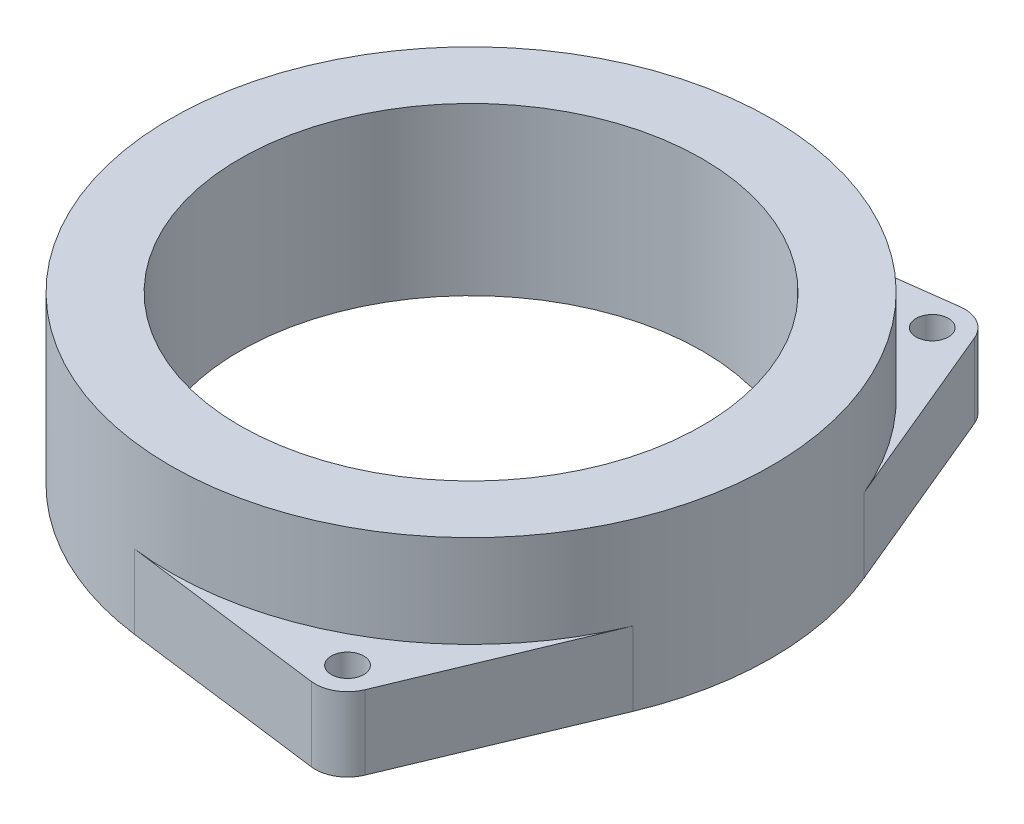
from build123d import *

# Parameters (mm, degrees)
CROQUIS1_R              = 25
CROQUIS1_R_2            = 1.75
SALIENTE_EXTRUIR1_DEPTH = 8
CROQUIS2_R              = 32.5
CROQUIS2_R_2            = 25
SALIENTE_EXTRUIR2_DEPTH = 10


with BuildPart() as part:
    # Croquis1 → Saliente-Extruir1 (new body)
    with BuildSketch(Plane(origin=(0, 0, 0), x_dir=(1, 0, 0), z_dir=(0, 1, 0))):
        with BuildLine():
            Line((-39.280821918, 2.125330436), (-25.821917808, 19.73521119))
            ThreePointArc((-25.821917808, 19.73521119), (-16.25, 28.145825623), (-4.180235335, 32.230042391))
            Line((-4.180235335, 32.230042391), (17.79982081, 35.08085488))
            ThreePointArc((17.79982081, 35.08085488), (20, 34.641016151), (21.481001108, 32.955524444))
            Line((21.481001108, 32.955524444), (30.002153144, 12.494831201))
            ThreePointArc((30.002153144, 12.494831201), (32.5, 0), (30.002153144, -12.494831201))
            Line((30.002153144, -12.494831201), (21.481001108, -32.955524444))
            ThreePointArc((21.481001108, -32.955524444), (20, -34.641016151), (17.79982081, -35.08085488))
            Line((17.79982081, -35.08085488), (-4.180235335, -32.230042391))
            ThreePointArc((-4.180235335, -32.230042391), (-16.25, -28.145825623), (-25.821917808, -19.73521119))
            Line((-25.821917808, -19.73521119), (-39.280821918, -2.125330436))
            ThreePointArc((-39.280821918, -2.125330436), (-40, 0), (-39.280821918, 2.125330436))
        make_face()
        with Locations(Location((0, 0, 0), (0, 0, 270))):
            Circle(CROQUIS1_R, mode=Mode.SUBTRACT)
        with Locations(Location((18.25, 31.609927238, 0), (0, 0, 270))):
            Circle(CROQUIS1_R_2, mode=Mode.SUBTRACT)
        with Locations(Location((-36.5, 0, 0), (0, 0, 270))):
            Circle(CROQUIS1_R_2, mode=Mode.SUBTRACT)
        with Locations(Location((18.25, -31.609927238, 0), (0, 0, 270))):
            Circle(CROQUIS1_R_2, mode=Mode.SUBTRACT)
    extrude(amount=SALIENTE_EXTRUIR1_DEPTH)

    # Croquis2 → Saliente-Extruir2 (add)
    with BuildSketch(Plane(origin=(0, 8, 0), x_dir=(1, 0, 0), z_dir=(0, 1, 0))):
        with Locations(Location((0, 0, 0), (0, 0, 97.390006376))):
            Circle(CROQUIS2_R)
        with Locations(Location((0, 0, 0), (0, 0, 270))):
            Circle(CROQUIS2_R_2, mode=Mode.SUBTRACT)
    extrude(amount=SALIENTE_EXTRUIR2_DEPTH)


solid = part.part
